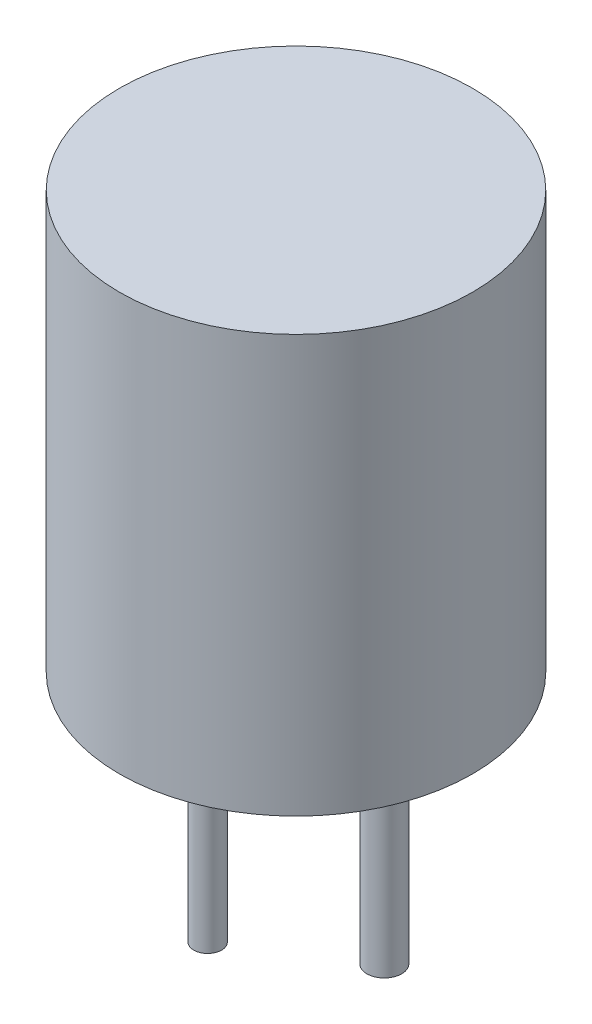
from build123d import *

# Parameters (mm, degrees)
SKETCH_1_R      = 5.08
EXTRUDE_1_DEPTH = 12
SKETCH_2_R      = 0.4
EXTRUDE_2_DEPTH = 8
SKETCH_3_R      = 0.5
EXTRUDE_3_DEPTH = 6


with BuildPart() as part:
    # 草图1 → 拉伸1 (new body)
    with BuildSketch(Plane(origin=(0, 0, 0), x_dir=(1, 0, 0), z_dir=(0, 1, 0))):
        with Locations(Location((0, 0, 0), (0, 0, 270))):
            Circle(SKETCH_1_R)
    extrude(amount=EXTRUDE_1_DEPTH)

    # 草图2 → 拉伸2 (add)
    with BuildSketch(Plane.XZ):
        with Locations(Location((-2.54, 0, 0), (0, 0, 90))):
            Circle(SKETCH_2_R)
    extrude(amount=EXTRUDE_2_DEPTH)

    # 草图3 → 拉伸3 (add)
    with BuildSketch(Plane.XZ):
        with Locations(Location((2.54, 0, 0), (0, 0, 90))):
            Circle(SKETCH_3_R)
    extrude(amount=EXTRUDE_3_DEPTH)


solid = part.part
